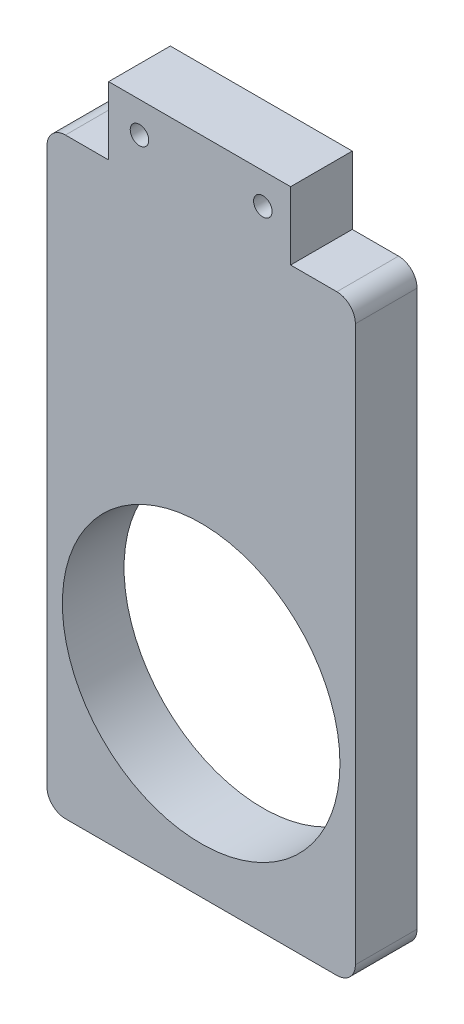
from build123d import *

# Parameters (mm, degrees)
IZIM1_R                     = 1.5
IZIM1_R_2                   = 22.5
Y_KSEKLIK_EKSTR_ZYON1_DEPTH = 10


with BuildPart() as part:
    # Çizim1 → Yükseklik-Ekstrüzyon1 (new body)
    with BuildSketch(Plane.XY.offset(10)):
        with BuildLine():
            Line((3, -38), (47, -38))
            ThreePointArc((47, -38), (49.121320344, -37.121320344), (50, -35))
            Line((50, -35), (50, 55))
            ThreePointArc((50, 55), (49.121320344, 57.121320344), (47, 58))
            Line((47, 58), (39.5, 58))
            Line((39.5, 58), (39.5, 69))
            Line((39.5, 69), (10, 69))
            Line((10, 69), (10, 58))
            Line((10, 58), (3, 58))
            ThreePointArc((3, 58), (0.878679656, 57.121320344), (0, 55))
            Line((0, 55), (0, -35))
            ThreePointArc((0, -35), (0.878679656, -37.121320344), (3, -38))
        make_face()
        with Locations(Location((15, 64, 0), (0, 0, 180))):
            Circle(IZIM1_R, mode=Mode.SUBTRACT)
        with Locations((25, -8)):
            Circle(IZIM1_R_2, mode=Mode.SUBTRACT)
        with Locations(Location((35, 64, 0), (0, 0, 180))):
            Circle(IZIM1_R, mode=Mode.SUBTRACT)
    extrude(amount=-Y_KSEKLIK_EKSTR_ZYON1_DEPTH)


solid = part.part
